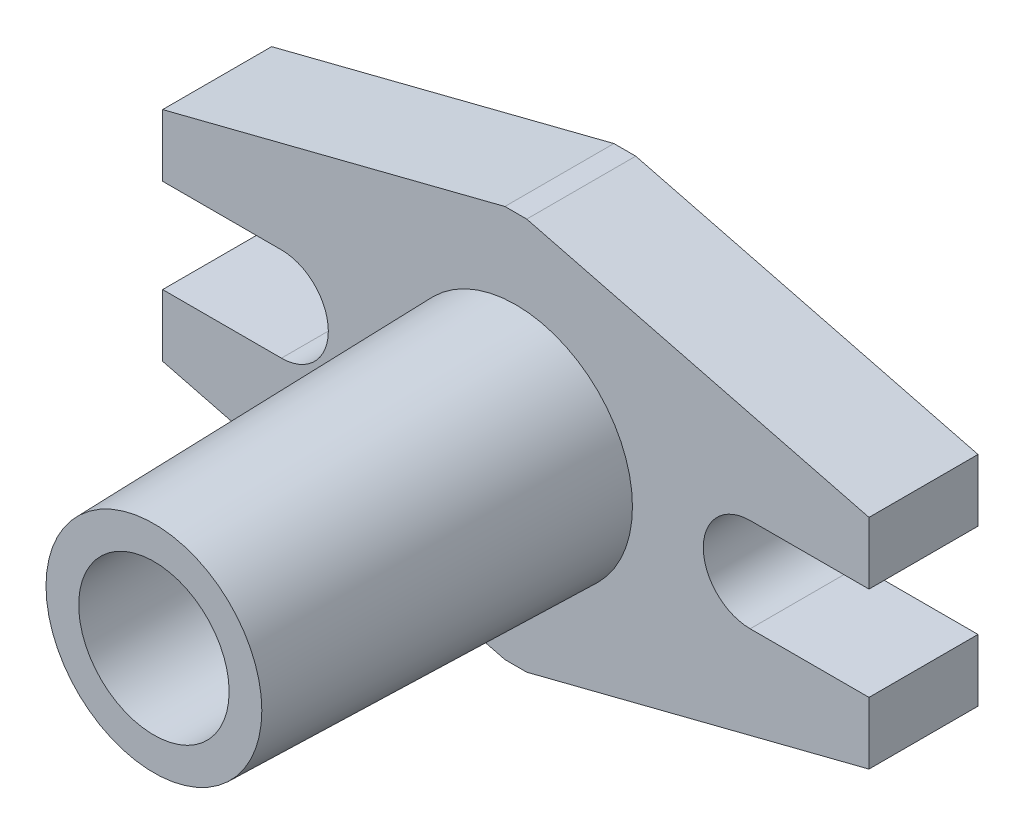
from build123d import *

# Parameters (mm, degrees)
BOSS_EXTRUDE1_DEPTH = 25
CUT_EXTRUDE1_REACH  = 144.302
SKETCH4_R           = 17.25


with BuildPart() as part:
    # Sketch1 → Boss-Extrude1 (new body)
    with BuildSketch(Plane.XY):
        with BuildLine():
            Line((-2.5, 45), (2.5, 45))
            Line((2.5, 45), (81, 25))
            Line((81, 25), (81, 10.75))
            Line((81, 10.75), (53.75, 10.75))
            ThreePointArc((53.75, 10.75), (43, 0), (53.75, -10.75))
            Line((53.75, -10.75), (81, -10.75))
            Line((81, -10.75), (81, -25))
            Line((81, -25), (2.5, -45))
            Line((2.5, -45), (-2.5, -45))
            Line((-2.5, -45), (-81, -25))
            Line((-81, -25), (-81, -10.75))
            Line((-81, -10.75), (-53.75, -10.75))
            ThreePointArc((-53.75, -10.75), (-43, 0), (-53.75, 10.75))
            Line((-53.75, 10.75), (-81, 10.75))
            Line((-81, 10.75), (-81, 25))
            Line((-81, 25), (-2.5, 45))
        make_face()
    extrude(amount=BOSS_EXTRUDE1_DEPTH)

    # Sketch3 → Revolve1 (revolve)
    with BuildSketch(Plane(origin=(0, 0, 0), x_dir=(0, 0, -1), z_dir=(1, 0, 0))):
        Polygon((-25, 26.75), (-108, 24.75), (-108, 0), (-25, 0), align=None)
    revolve(axis=Axis((0, 0, 220.421976321), (0, 0, -1)))

    # Sketch4 → Cut-Extrude1 (cut, up to next)
    with BuildSketch(Plane.XY.offset(108), mode=Mode.PRIVATE) as cut_extrude1_sk1:
        Circle(SKETCH4_R)
    cut_extrude1_tool1 = extrude(cut_extrude1_sk1.sketch, amount=-CUT_EXTRUDE1_REACH, mode=Mode.PRIVATE) & part.part
    add(cut_extrude1_tool1.solids().sort_by_distance((0, 0, 108))[0], mode=Mode.SUBTRACT)


solid = part.part
